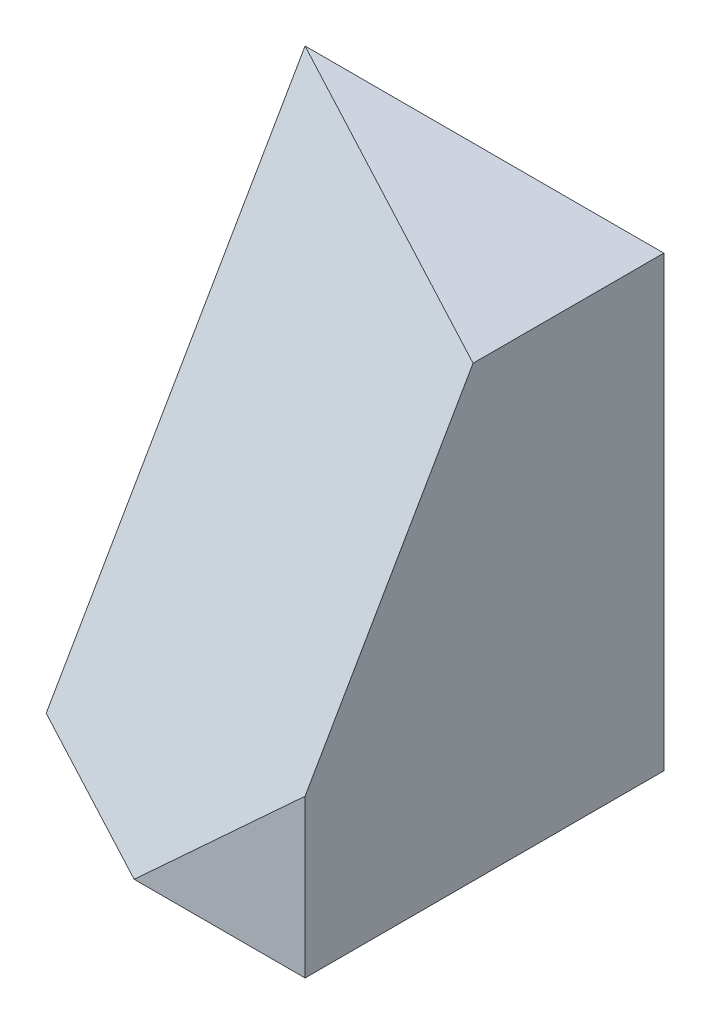
from build123d import *

# Parameters (mm, degrees)
SKETCH_1_W      = 48
SKETCH_1_H      = 48
EXTRUDE_1_DEPTH = 60


with BuildPart() as part:
    # 草图1 → 凸台-拉伸1 (new body)
    with BuildSketch(Plane(origin=(0, 0, 0), x_dir=(1, 0, 0), z_dir=(0, 1, 0))):
        Rectangle(SKETCH_1_W, SKETCH_1_H)
    extrude(amount=EXTRUDE_1_DEPTH)

    # Surface Cut 1
    split(bisect_by=Plane(origin=(-7.699699993, 8.36062631, 14.481029553), x_dir=(-0.9083269633698448, -0.20913041840877644, -0.3622245100921344), z_dir=(0.41826083681754944, -0.4541634816849261, -0.7866342252206606)), keep=Keep.TOP)


solid = part.part
